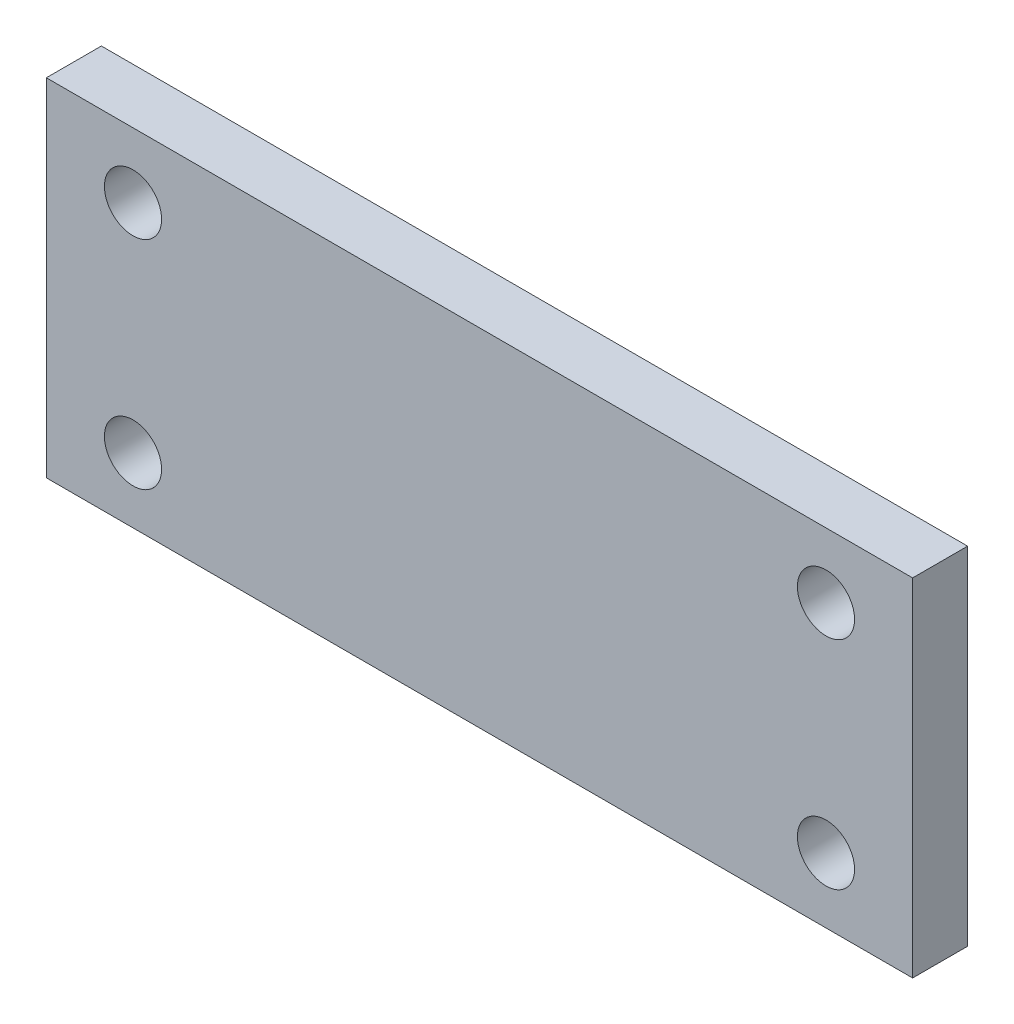
from build123d import *

# Parameters (mm, degrees)
SKETCH1_W           = 100
SKETCH1_H           = 40
SKETCH1_R           = 3.3
BOSS_EXTRUDE1_DEPTH = 3.175


with BuildPart() as part:
    # Sketch1 → Boss-Extrude1 (new, symmetric)
    with BuildSketch(Plane.XY):
        Rectangle(SKETCH1_W, SKETCH1_H)
        with Locations((-40, 12.5)):
            Circle(SKETCH1_R, mode=Mode.SUBTRACT)
        with Locations((-40, -12.5)):
            Circle(SKETCH1_R, mode=Mode.SUBTRACT)
        with Locations(Location((40, -12.5, 0), (0, 0, 180))):
            Circle(SKETCH1_R, mode=Mode.SUBTRACT)
        with Locations(Location((40, 12.5, 0), (0, 0, 180))):
            Circle(SKETCH1_R, mode=Mode.SUBTRACT)
    extrude(amount=BOSS_EXTRUDE1_DEPTH, both=True)


solid = part.part
